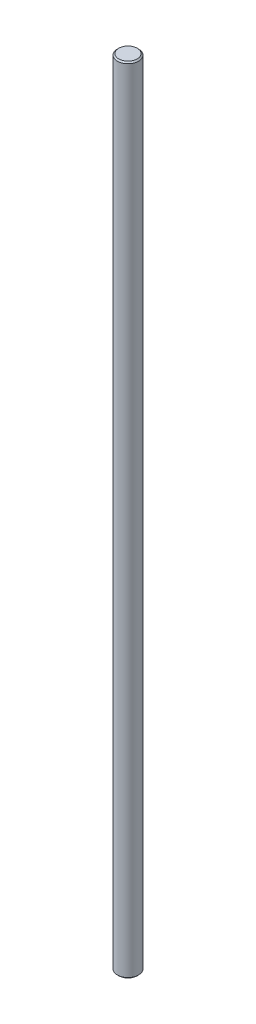
from build123d import *

# Parameters (mm, degrees)
SKETCH1_R           = 4
BOSS_EXTRUDE1_DEPTH = 150
CHAMFER1_SIZE       = 0.5


with BuildPart() as part:
    # Sketch1 → Boss-Extrude1 (new, symmetric)
    with BuildSketch(Plane(origin=(0, 0, 0), x_dir=(1, 0, 0), z_dir=(0, 1, 0))):
        with Locations(Location((0, 0, 0), (0, 0, 270))):
            Circle(SKETCH1_R)
    extrude(amount=BOSS_EXTRUDE1_DEPTH, both=True)

    # Chamfer1
    chamfer1_edges = [part.edges().sort_by_distance(p)[0] for p in [
        (0, -150, -4),
        (0, 150, -4),
    ]]
    chamfer(chamfer1_edges, length=CHAMFER1_SIZE)


solid = part.part
